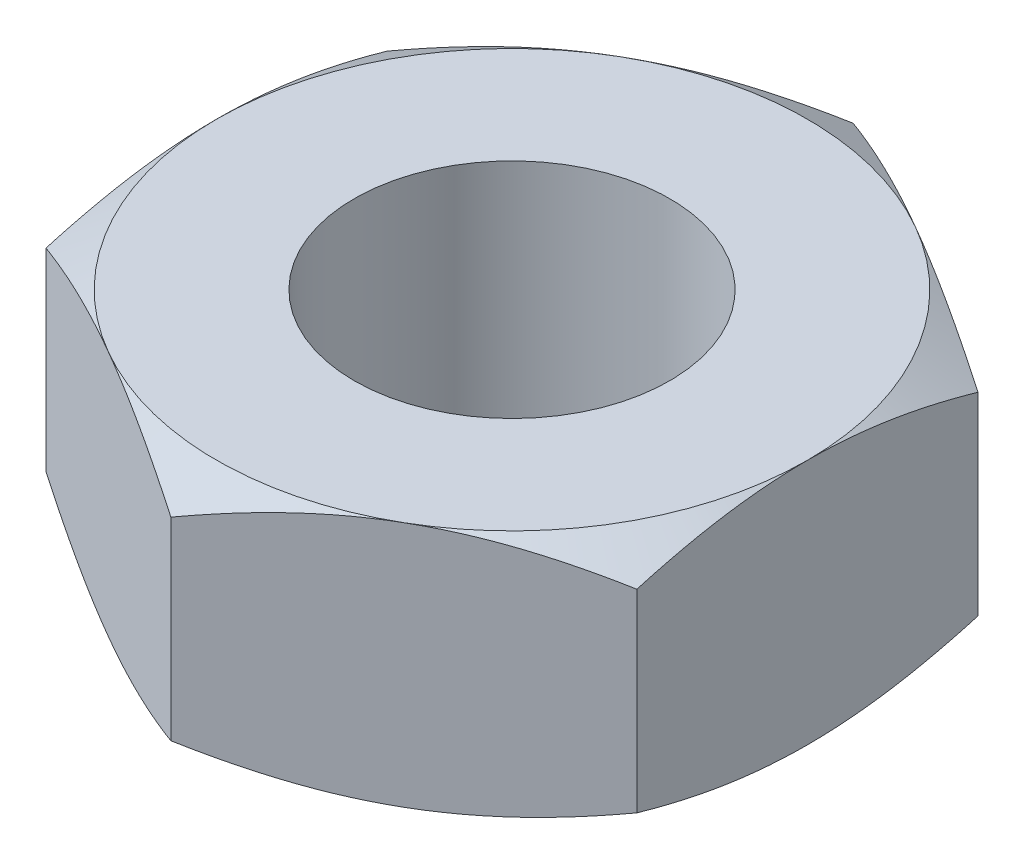
from build123d import *

# Parameters (mm, degrees)
SKETCH1_R               = 18.5
BOSS_EXTRUDE1_DEPTH     = 14.45
SKETCH2_OUTSIDE_W       = 305.548
SKETCH2_OUTSIDE_H       = 316.266
SKETCH2_OUTSIDE_R       = 34.641016151
CUT_EXTRUDE1_DEPTH      = 61.292702709
CUT_EXTRUDE1_DRAFT      = -60
MIRROR1_COPY_1_SKETCH_W = 305.548
MIRROR1_COPY_1_SKETCH_H = 316.266
MIRROR1_COPY_1_SKETCH_R = 34.641016151
MIRROR1_COPY_1_DEPTH    = 61.292702709
MIRROR1_COPY_1_DRAFT    = -60


with BuildPart() as part:
    # Sketch1 → Boss-Extrude1 (new, symmetric)
    with BuildSketch(Plane(origin=(0, 0, 0), x_dir=(1, 0, 0), z_dir=(0, 1, 0))):
        Polygon((0, 40), (-34.641016151, 20), (-34.641016151, -20), (0, -40), (34.641016151, -20), (34.641016151, 20), align=None)
        with Locations(Location((0, 0, 0), (0, 0, 270))):
            Circle(SKETCH1_R, mode=Mode.SUBTRACT)
    extrude(amount=BOSS_EXTRUDE1_DEPTH, both=True)


with BuildPart() as cut_extrude1_tool:
    # Sketch2 outside → Cut-Extrude1 (with draft: the straight prism first)
    with BuildSketch(Plane(origin=(0, 14.45, 0), x_dir=(1, 0, 0), z_dir=(0, 1, 0))):
        Rectangle(SKETCH2_OUTSIDE_W, SKETCH2_OUTSIDE_H)
        Circle(SKETCH2_OUTSIDE_R, mode=Mode.SUBTRACT)
    extrude(amount=-CUT_EXTRUDE1_DEPTH)
    # Cut-Extrude1: the draft: its side faces are tilted about the plane it starts from
    cut_extrude1_sides = [cut_extrude1_tool.faces().sort_by_distance(p)[0] for p in [
        (0, -16.196351355, 158.133),
        (152.774, -16.196351355, 0),
        (0, -16.196351355, -158.133),
        (-152.774, -16.196351355, 0),
        (-34.641016151, -16.196351355, 0),
    ]]
    draft(cut_extrude1_sides, Plane(origin=(0, 14.45, 0), x_dir=(1, 0, 0), z_dir=(0, 1, 0)), CUT_EXTRUDE1_DRAFT)


with BuildPart() as part_1:
    add(part.part)

    # Cut-Extrude1: cut by cut_extrude1_tool
    add(cut_extrude1_tool.part, mode=Mode.SUBTRACT)


with BuildPart() as mirror1_copy_1_tool:
    # Mirror1 copy 1 sketch → Mirror1 copy 1 (with draft: the straight prism first)
    with BuildSketch(Plane.XZ.offset(14.45)):
        Rectangle(MIRROR1_COPY_1_SKETCH_W, MIRROR1_COPY_1_SKETCH_H)
        Circle(MIRROR1_COPY_1_SKETCH_R, mode=Mode.SUBTRACT)
    extrude(amount=-MIRROR1_COPY_1_DEPTH)
    # Mirror1 copy 1: the draft: its side faces are tilted about the plane it starts from
    mirror1_copy_1_sides = [mirror1_copy_1_tool.faces().sort_by_distance(p)[0] for p in [
        (0, 16.196351355, 158.133),
        (152.774, 16.196351355, 0),
        (0, 16.196351355, -158.133),
        (-152.774, 16.196351355, 0),
        (-34.641016151, 16.196351355, 0),
    ]]
    draft(mirror1_copy_1_sides, Plane.XZ.offset(14.45), MIRROR1_COPY_1_DRAFT)


with BuildPart() as part_2:
    add(part_1.part)

    # Mirror1 copy 1: cut by mirror1_copy_1_tool
    add(mirror1_copy_1_tool.part, mode=Mode.SUBTRACT)


solid = part_2.part
